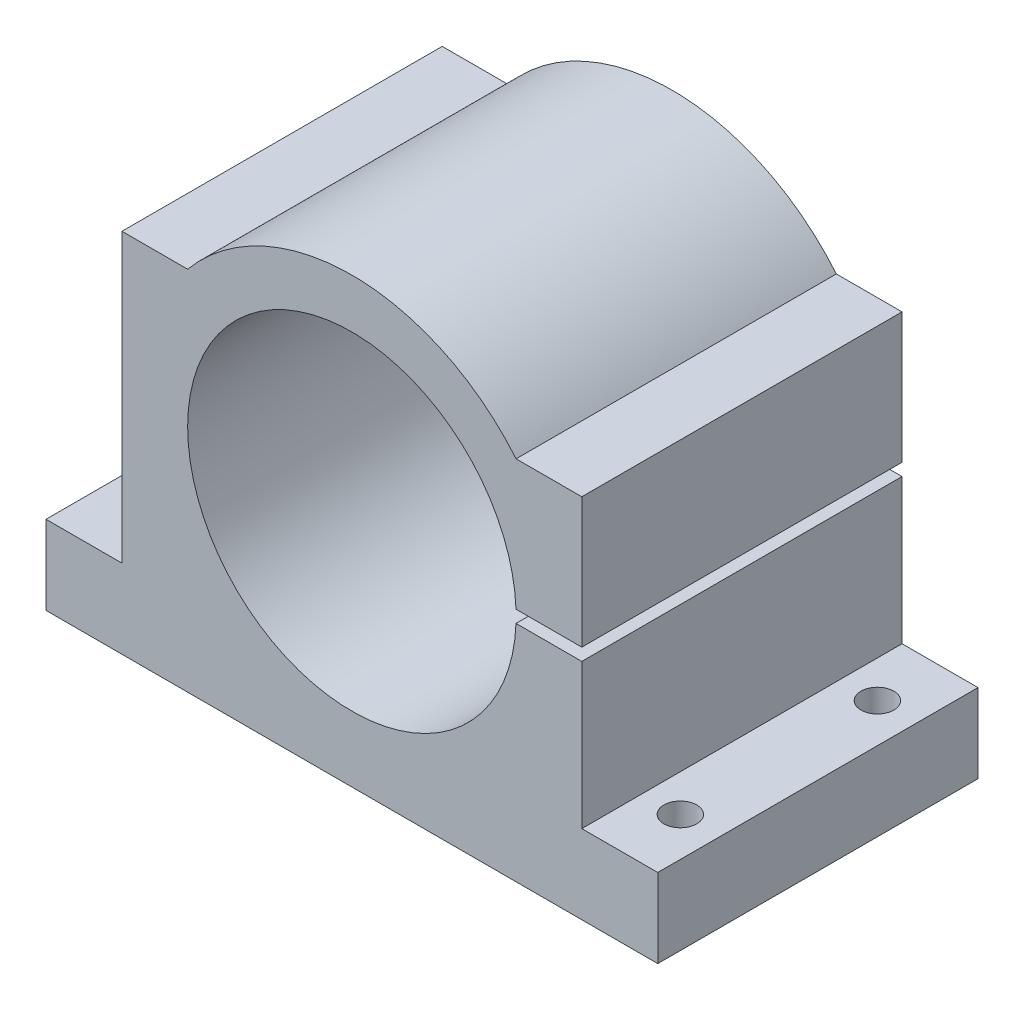
from build123d import *

# Parameters (mm, degrees)
BOSS_EXTRUDE1_DEPTH = 78
SKETCH2_R           = 4
CUT_EXTRUDE1_DEPTH  = 200.872459333


with BuildPart() as part:
    # Sketch1 → Boss-Extrude1 (new body)
    with BuildSketch(Plane.XY):
        with BuildLine():
            Line((0, 19.226495452), (18.5, 19.226495452))
            Line((18.5, 19.226495452), (18.5, 89.226495452))
            Line((18.5, 89.226495452), (34.5, 89.226495452))
            ThreePointArc((34.5, 89.226495452), (74.5, 108), (114.5, 89.226495452))
            Line((114.5, 89.226495452), (130.5, 89.226495452))
            Line((130.5, 89.226495452), (130.5, 57.5))
            Line((130.5, 57.5), (114.471865105, 57.5))
            ThreePointArc((114.471865105, 57.5), (34.5, 56), (114.471865105, 54.5))
            Line((114.471865105, 54.5), (130.5, 54.5))
            Line((130.5, 54.5), (130.5, 19.226495452))
            Line((130.5, 19.226495452), (149, 19.226495452))
            Line((149, 19.226495452), (149, 0))
            Line((149, 0), (0, 0))
            Line((0, 0), (0, 19.226495452))
        make_face()
    extrude(amount=BOSS_EXTRUDE1_DEPTH)

    # Sketch2 → Cut-Extrude1 (cut, through all)
    with BuildSketch(Plane.XZ):
        with Locations((9.5, 63)):
            Circle(SKETCH2_R)
        with Locations((139.5, 63)):
            Circle(SKETCH2_R)
        with Locations((9.5, 15)):
            Circle(SKETCH2_R)
        with Locations((139.5, 15)):
            Circle(SKETCH2_R)
    extrude(amount=-CUT_EXTRUDE1_DEPTH, mode=Mode.SUBTRACT)


solid = part.part
